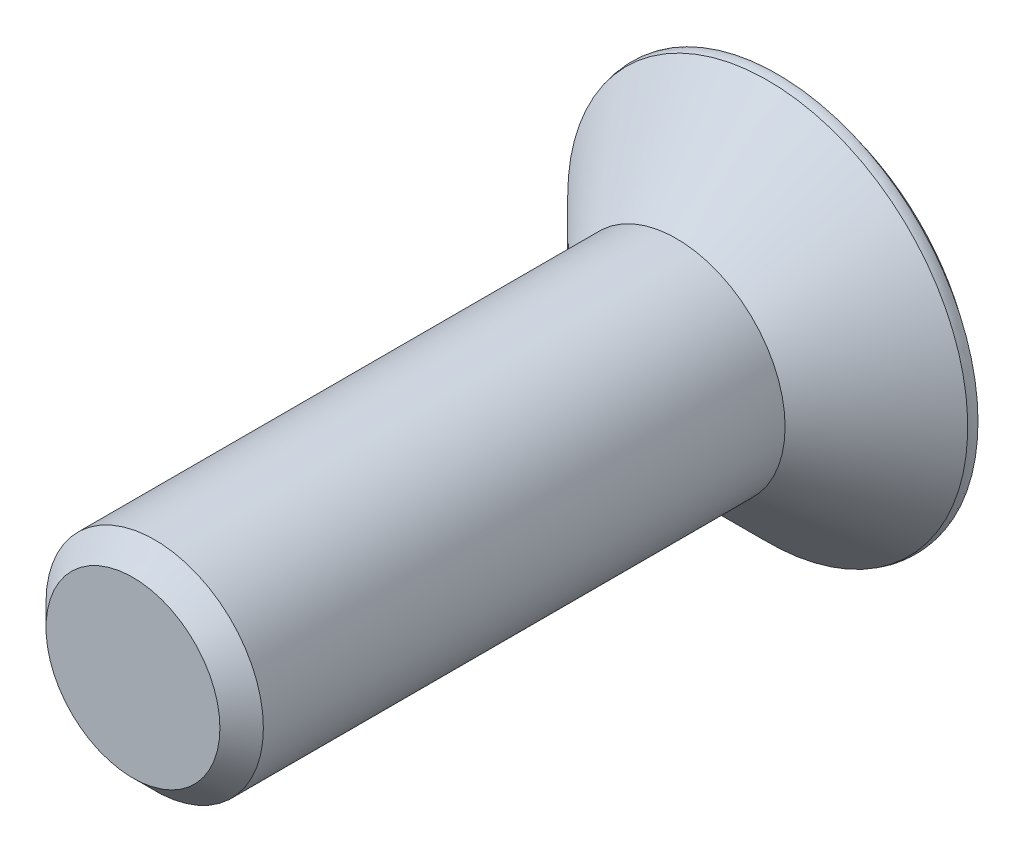
from build123d import *

# Parameters (mm, degrees)
ENLEV_MAT_EXTRU_1_DEPTH      = 1
ENLEV_MAT_EXTRU_1_DEPTH_BACK = 10
ESQUISSE3_W                  = 2
ESQUISSE3_H                  = 10
CHANFREIN1_SIZE              = 0.4
ENL_V_MAT_EXTRU_1_DEPTH      = 1


with BuildPart() as part:
    # Esquisse1 → Base-Révolution (revolve)
    with BuildSketch(Plane(origin=(0, 0, 0), x_dir=(1, 0, 0), z_dir=(0, 1, 0))):
        with BuildLine():
            Line((0, 0), (2, 0))
            Line((2, 0), (3.680261609, 1.680261609))
            ThreePointArc((3.680261609, 1.680261609), (3.699400389, 1.768324283), (3.691522185, 1.858097672))
            ThreePointArc((3.691522185, 1.858097672), (1.958780857, 2.831960417), (0, 3.169567743))
            Line((0, 3.169567743), (0, 0))
        make_face()
    revolve(axis=Axis((0, 0, 0), (0, 0, -1)))

    # Esquisse2 → Enlev. mat.-Extru.1 (cut, two sides: drawn at the far end of the back side and taken through both)
    with BuildSketch(Plane.XY.offset(-3.1).offset(-ENLEV_MAT_EXTRU_1_DEPTH_BACK)):
        Polygon((0.6, -0.6), (0.6, -2.35), (-0.6, -2.35), (-0.6, -0.6), (-2.35, -0.6), (-2.35, 0.6), (-0.6, 0.6), (-0.6, 2.35), (0.6, 2.35), (0.6, 0.6), (2.35, 0.6), (2.35, -0.6), align=None)
    extrude(amount=ENLEV_MAT_EXTRU_1_DEPTH + ENLEV_MAT_EXTRU_1_DEPTH_BACK, mode=Mode.SUBTRACT)

    # Esquisse3 → Boss.-Révol.1 (revolve)
    with BuildSketch(Plane(origin=(0, 0, 0), x_dir=(1, 0, 0), z_dir=(0, 1, 0))):
        with Locations((1, -5)):
            Rectangle(ESQUISSE3_W, ESQUISSE3_H)
    revolve(axis=Axis((0, 0, 0), (0, 0, 1)))

    # Chanfrein1
    chanfrein1_edges = [part.edges().sort_by_distance(p)[0] for p in [
        (-2, 0, 10),
    ]]
    chamfer(chanfrein1_edges, length=CHANFREIN1_SIZE)

    # Esquisse6 → Enlèv. mat.-Extru.1 (cut)
    with BuildSketch(Plane(origin=(0, 0, -2.1), x_dir=(-1, 0, 0), z_dir=(0, 0, -1))):
        Polygon((2.35, 0.6), (0.6, 0.6), (0.6, 2.35), (-0.6, 2.35), (-0.6, 0.6), (-2.35, 0.6), (-2.35, -0.6), (-0.6, -0.6), (-0.6, -2.35), (0.6, -2.35), (0.6, -0.6), (2.35, -0.6), align=None)
    extrude(amount=-ENL_V_MAT_EXTRU_1_DEPTH, mode=Mode.SUBTRACT)


solid = part.part
